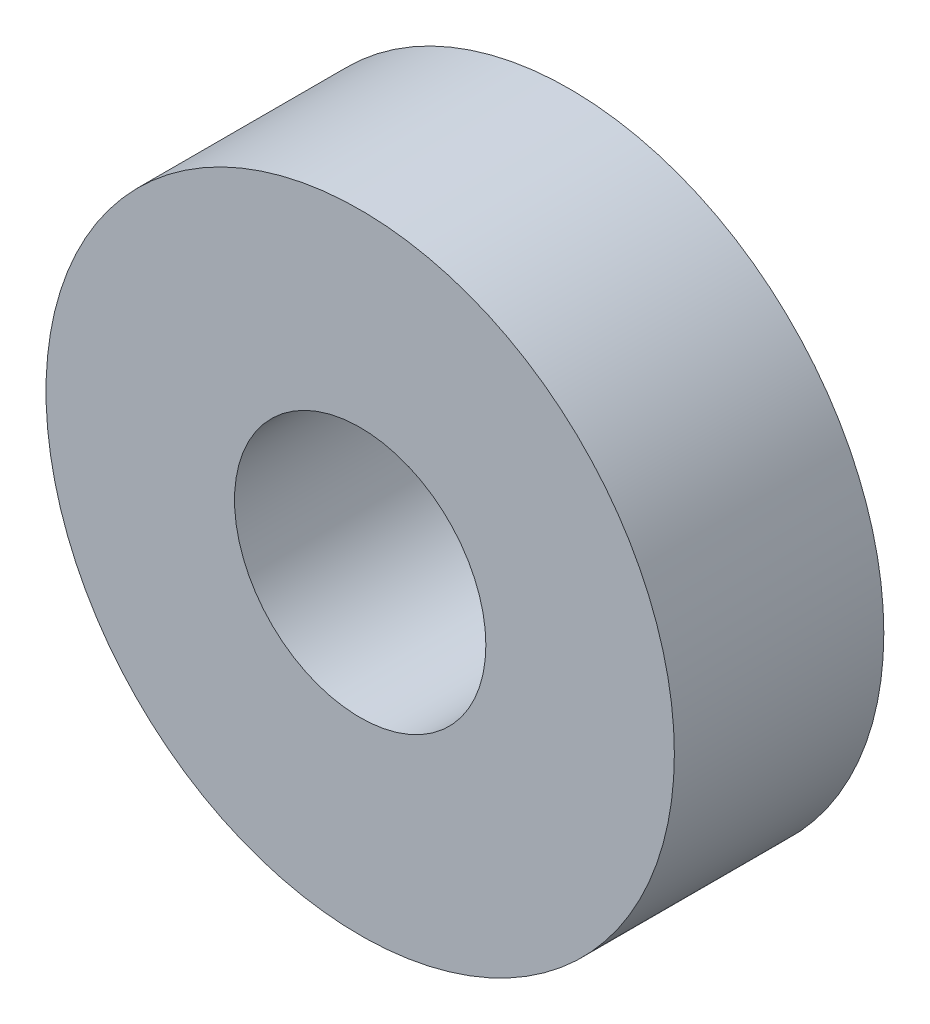
from build123d import *

# Parameters (mm, degrees)
SKETCH1_R           = 15
SKETCH1_R_2         = 6
BOSS_EXTRUDE1_DEPTH = 10


with BuildPart() as part:
    # Sketch1 → Boss-Extrude1 (new body)
    with BuildSketch(Plane.XY):
        Circle(SKETCH1_R)
        Circle(SKETCH1_R_2, mode=Mode.SUBTRACT)
    extrude(amount=BOSS_EXTRUDE1_DEPTH)


solid = part.part
